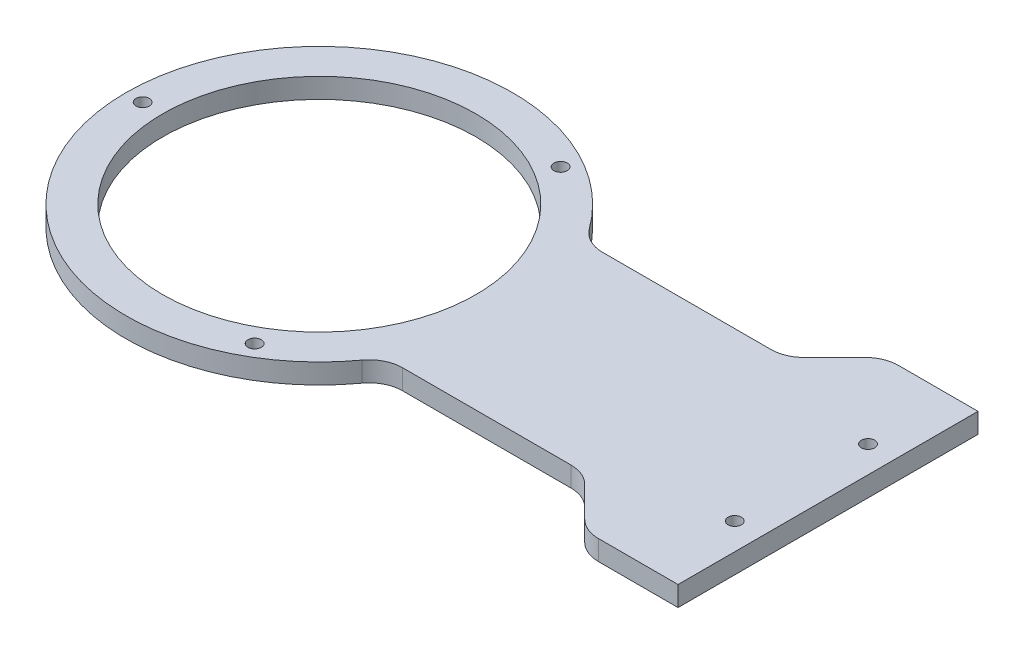
from build123d import *

# Parameters (mm, degrees)
SKETCH2_R           = 23.5
SKETCH2_R_2         = 1
BOSS_EXTRUDE1_DEPTH = 3
FILLET1_R           = 5
SKETCH3_R           = 1
CUT_EXTRUDE1_DEPTH  = 3
CIRPATTERN1_COUNT   = 3


with BuildPart() as part:
    # Sketch2 → Boss-Extrude1 (new body)
    with BuildSketch(Plane(origin=(0, 0, 0), x_dir=(1, 0, 0), z_dir=(0, 1, 0))):
        with BuildLine():
            Line((24.819347292, 15), (54.819347292, 15))
            Line((54.819347292, 15), (62.319347292, 22.5))
            Line((62.319347292, 22.5), (76.319347292, 22.5))
            Line((76.319347292, 22.5), (76.319347292, -22.5))
            Line((76.319347292, -22.5), (62.319347292, -22.5))
            Line((62.319347292, -22.5), (54.819347292, -15))
            Line((54.819347292, -15), (24.819347292, -15))
            ThreePointArc((24.819347292, -15), (-29, 0), (24.819347292, 15))
        make_face()
        with Locations(Location((0, 0, 0), (0, 0, 270))):
            Circle(SKETCH2_R, mode=Mode.SUBTRACT)
        with Locations(Location((72.319347292, 10, 0), (0, 0, 270))):
            Circle(SKETCH2_R_2, mode=Mode.SUBTRACT)
        with Locations(Location((72.319347292, -10, 0), (0, 0, 270))):
            Circle(SKETCH2_R_2, mode=Mode.SUBTRACT)
    extrude(amount=BOSS_EXTRUDE1_DEPTH)

    # Fillet1
    fillet1_edges = [part.edges().sort_by_distance(p)[0] for p in [
        (54.819347292, 1.5, -15),
        (62.319347292, 1.5, -22.5),
        (62.319347292, 1.5, 22.5),
        (54.819347292, 1.5, 15),
        (24.819347292, 1.5, 15),
        (24.819347292, 1.5, -15),
    ]]
    fillet(fillet1_edges, radius=FILLET1_R)

    # Sketch3 → Cut-Extrude1 (cut)
    with BuildSketch(Plane(origin=(0, 3, 0), x_dir=(1, 0, 0), z_dir=(0, 1, 0))):
        with Locations(Location((13.25, 22.9496732, 0), (0, 0, 270))):
            Circle(SKETCH3_R)
    cut_extrude1 = extrude(amount=-CUT_EXTRUDE1_DEPTH, mode=Mode.SUBTRACT)

    # CirPattern1: Cut-Extrude1 ×3 about axis
    cirpattern1_axis = Axis((0, 0, 0), (0, 1, 0))
    for i in range(1, CIRPATTERN1_COUNT):
        add(cut_extrude1.rotate(cirpattern1_axis, i * 360 / CIRPATTERN1_COUNT), mode=Mode.SUBTRACT)


solid = part.part
